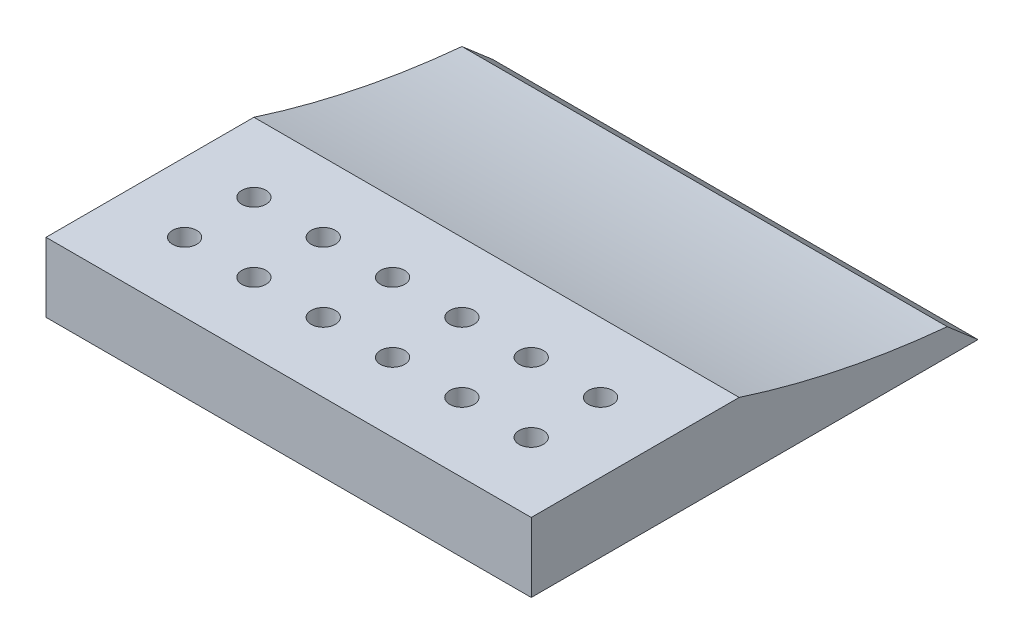
from build123d import *

# Parameters (mm, degrees)
SKETCH2_W           = 60
SKETCH2_H           = 10
BOSS_EXTRUDE1_DEPTH = 70
SKETCH3_R           = 140
CUT_EXTRUDE1_DEPTH  = 70
BOSS_EXTRUDE2_DEPTH = 70
CUT_EXTRUDE2_REACH  = 97.669
SKETCH6_R           = 1.75
SKETCH8_R           = 3
CUT_EXTRUDE3_DEPTH  = 3


with BuildPart() as part:
    # Sketch2 → Boss-Extrude1 (new body)
    with BuildSketch(Plane(origin=(0, 0, 0), x_dir=(0, 0, -1), z_dir=(1, 0, 0))):
        with Locations((30, 5)):
            Rectangle(SKETCH2_W, SKETCH2_H)
    extrude(amount=BOSS_EXTRUDE1_DEPTH)

    # Sketch3 → Cut-Extrude1 (cut)
    with BuildSketch(Plane(origin=(70, 0, 0), x_dir=(0, 0, -1), z_dir=(1, 0, 0))):
        with Locations((73, 143.23)):
            Circle(SKETCH3_R)
    extrude(amount=-CUT_EXTRUDE1_DEPTH, mode=Mode.SUBTRACT)

    # Sketch5 → Boss-Extrude2 (add)
    with BuildSketch(Plane(origin=(70, 0, 0), x_dir=(0, 0, -1), z_dir=(1, 0, 0))):
        Polygon((60, 0), (60, 3.834878134), (64.44091692, 0), align=None)
    extrude(amount=-BOSS_EXTRUDE2_DEPTH)

    # Sketch6 → Cut-Extrude2 (cut, up to next)
    with BuildSketch(Plane(origin=(0, 10, 0), x_dir=(1, 0, 0), z_dir=(0, 1, 0)), mode=Mode.PRIVATE) as cut_extrude2_sk1:
        with Locations(Location((60, 19.991081158, 0), (0, 0, 270))):
            Circle(SKETCH6_R)
    cut_extrude2_tool1 = extrude(cut_extrude2_sk1.sketch, amount=-CUT_EXTRUDE2_REACH, mode=Mode.PRIVATE) & part.part
    # Sketch6 → Cut-Extrude2 (cut, up to next)
    with BuildSketch(Plane(origin=(0, 10, 0), x_dir=(1, 0, 0), z_dir=(0, 1, 0)), mode=Mode.PRIVATE) as cut_extrude2_sk2:
        with Locations(Location((50, 19.991081158, 0), (0, 0, 270))):
            Circle(SKETCH6_R)
    cut_extrude2_tool2 = extrude(cut_extrude2_sk2.sketch, amount=-CUT_EXTRUDE2_REACH, mode=Mode.PRIVATE) & part.part
    # Sketch6 → Cut-Extrude2 (cut, up to next)
    with BuildSketch(Plane(origin=(0, 10, 0), x_dir=(1, 0, 0), z_dir=(0, 1, 0)), mode=Mode.PRIVATE) as cut_extrude2_sk3:
        with Locations(Location((40, 19.991081158, 0), (0, 0, 270))):
            Circle(SKETCH6_R)
    cut_extrude2_tool3 = extrude(cut_extrude2_sk3.sketch, amount=-CUT_EXTRUDE2_REACH, mode=Mode.PRIVATE) & part.part
    # Sketch6 → Cut-Extrude2 (cut, up to next)
    with BuildSketch(Plane(origin=(0, 10, 0), x_dir=(1, 0, 0), z_dir=(0, 1, 0)), mode=Mode.PRIVATE) as cut_extrude2_sk4:
        with Locations(Location((30, 19.991081158, 0), (0, 0, 270))):
            Circle(SKETCH6_R)
    cut_extrude2_tool4 = extrude(cut_extrude2_sk4.sketch, amount=-CUT_EXTRUDE2_REACH, mode=Mode.PRIVATE) & part.part
    # Sketch6 → Cut-Extrude2 (cut, up to next)
    with BuildSketch(Plane(origin=(0, 10, 0), x_dir=(1, 0, 0), z_dir=(0, 1, 0)), mode=Mode.PRIVATE) as cut_extrude2_sk5:
        with Locations(Location((20, 19.991081158, 0), (0, 0, 270))):
            Circle(SKETCH6_R)
    cut_extrude2_tool5 = extrude(cut_extrude2_sk5.sketch, amount=-CUT_EXTRUDE2_REACH, mode=Mode.PRIVATE) & part.part
    # Sketch6 → Cut-Extrude2 (cut, up to next)
    with BuildSketch(Plane(origin=(0, 10, 0), x_dir=(1, 0, 0), z_dir=(0, 1, 0)), mode=Mode.PRIVATE) as cut_extrude2_sk6:
        with Locations(Location((10, 19.991081158, 0), (0, 0, 270))):
            Circle(SKETCH6_R)
    cut_extrude2_tool6 = extrude(cut_extrude2_sk6.sketch, amount=-CUT_EXTRUDE2_REACH, mode=Mode.PRIVATE) & part.part
    # Sketch6 → Cut-Extrude2 (cut, up to next)
    with BuildSketch(Plane(origin=(0, 10, 0), x_dir=(1, 0, 0), z_dir=(0, 1, 0)), mode=Mode.PRIVATE) as cut_extrude2_sk7:
        with Locations(Location((10, 9.991081158, 0), (0, 0, 270))):
            Circle(SKETCH6_R)
    cut_extrude2_tool7 = extrude(cut_extrude2_sk7.sketch, amount=-CUT_EXTRUDE2_REACH, mode=Mode.PRIVATE) & part.part
    # Sketch6 → Cut-Extrude2 (cut, up to next)
    with BuildSketch(Plane(origin=(0, 10, 0), x_dir=(1, 0, 0), z_dir=(0, 1, 0)), mode=Mode.PRIVATE) as cut_extrude2_sk8:
        with Locations(Location((20, 9.991081158, 0), (0, 0, 270))):
            Circle(SKETCH6_R)
    cut_extrude2_tool8 = extrude(cut_extrude2_sk8.sketch, amount=-CUT_EXTRUDE2_REACH, mode=Mode.PRIVATE) & part.part
    # Sketch6 → Cut-Extrude2 (cut, up to next)
    with BuildSketch(Plane(origin=(0, 10, 0), x_dir=(1, 0, 0), z_dir=(0, 1, 0)), mode=Mode.PRIVATE) as cut_extrude2_sk9:
        with Locations(Location((30, 9.991081158, 0), (0, 0, 270))):
            Circle(SKETCH6_R)
    cut_extrude2_tool9 = extrude(cut_extrude2_sk9.sketch, amount=-CUT_EXTRUDE2_REACH, mode=Mode.PRIVATE) & part.part
    # Sketch6 → Cut-Extrude2 (cut, up to next)
    with BuildSketch(Plane(origin=(0, 10, 0), x_dir=(1, 0, 0), z_dir=(0, 1, 0)), mode=Mode.PRIVATE) as cut_extrude2_sk10:
        with Locations(Location((40, 9.991081158, 0), (0, 0, 270))):
            Circle(SKETCH6_R)
    cut_extrude2_tool10 = extrude(cut_extrude2_sk10.sketch, amount=-CUT_EXTRUDE2_REACH, mode=Mode.PRIVATE) & part.part
    # Sketch6 → Cut-Extrude2 (cut, up to next)
    with BuildSketch(Plane(origin=(0, 10, 0), x_dir=(1, 0, 0), z_dir=(0, 1, 0)), mode=Mode.PRIVATE) as cut_extrude2_sk11:
        with Locations(Location((50, 9.991081158, 0), (0, 0, 270))):
            Circle(SKETCH6_R)
    cut_extrude2_tool11 = extrude(cut_extrude2_sk11.sketch, amount=-CUT_EXTRUDE2_REACH, mode=Mode.PRIVATE) & part.part
    # Sketch6 → Cut-Extrude2 (cut, up to next)
    with BuildSketch(Plane(origin=(0, 10, 0), x_dir=(1, 0, 0), z_dir=(0, 1, 0)), mode=Mode.PRIVATE) as cut_extrude2_sk12:
        with Locations(Location((60, 9.991081158, 0), (0, 0, 270))):
            Circle(SKETCH6_R)
    cut_extrude2_tool12 = extrude(cut_extrude2_sk12.sketch, amount=-CUT_EXTRUDE2_REACH, mode=Mode.PRIVATE) & part.part
    add(cut_extrude2_tool1.solids().sort_by_distance((60, 10, -19.991081))[0], mode=Mode.SUBTRACT)
    add(cut_extrude2_tool2.solids().sort_by_distance((50, 10, -19.991081))[0], mode=Mode.SUBTRACT)
    add(cut_extrude2_tool3.solids().sort_by_distance((40, 10, -19.991081))[0], mode=Mode.SUBTRACT)
    add(cut_extrude2_tool4.solids().sort_by_distance((30, 10, -19.991081))[0], mode=Mode.SUBTRACT)
    add(cut_extrude2_tool5.solids().sort_by_distance((20, 10, -19.991081))[0], mode=Mode.SUBTRACT)
    add(cut_extrude2_tool6.solids().sort_by_distance((10, 10, -19.991081))[0], mode=Mode.SUBTRACT)
    add(cut_extrude2_tool7.solids().sort_by_distance((10, 10, -9.991081))[0], mode=Mode.SUBTRACT)
    add(cut_extrude2_tool8.solids().sort_by_distance((20, 10, -9.991081))[0], mode=Mode.SUBTRACT)
    add(cut_extrude2_tool9.solids().sort_by_distance((30, 10, -9.991081))[0], mode=Mode.SUBTRACT)
    add(cut_extrude2_tool10.solids().sort_by_distance((40, 10, -9.991081))[0], mode=Mode.SUBTRACT)
    add(cut_extrude2_tool11.solids().sort_by_distance((50, 10, -9.991081))[0], mode=Mode.SUBTRACT)
    add(cut_extrude2_tool12.solids().sort_by_distance((60, 10, -9.991081))[0], mode=Mode.SUBTRACT)

    # Sketch8 → Cut-Extrude3 (cut)
    with BuildSketch(Plane.XZ):
        with Locations(Location((10, -9.991081158, 0), (0, 0, 270))):
            Circle(SKETCH8_R)
        with Locations(Location((20, -9.991081158, 0), (0, 0, 270))):
            Circle(SKETCH8_R)
        with Locations(Location((30, -9.991081158, 0), (0, 0, 270))):
            Circle(SKETCH8_R)
        with Locations(Location((40, -9.991081158, 0), (0, 0, 270))):
            Circle(SKETCH8_R)
        with Locations(Location((50, -9.991081158, 0), (0, 0, 270))):
            Circle(SKETCH8_R)
        with Locations(Location((60, -9.991081158, 0), (0, 0, 270))):
            Circle(SKETCH8_R)
        with Locations(Location((20, -19.991081158, 0), (0, 0, 270))):
            Circle(SKETCH8_R)
        with Locations(Location((30, -19.991081158, 0), (0, 0, 270))):
            Circle(SKETCH8_R)
        with Locations(Location((40, -19.991081158, 0), (0, 0, 270))):
            Circle(SKETCH8_R)
        with Locations(Location((50, -19.991081158, 0), (0, 0, 270))):
            Circle(SKETCH8_R)
        with Locations(Location((60, -19.991081158, 0), (0, 0, 270))):
            Circle(SKETCH8_R)
        with Locations(Location((10, -19.991081158, 0), (0, 0, 270))):
            Circle(SKETCH8_R)
    extrude(amount=-CUT_EXTRUDE3_DEPTH, mode=Mode.SUBTRACT)


solid = part.part
